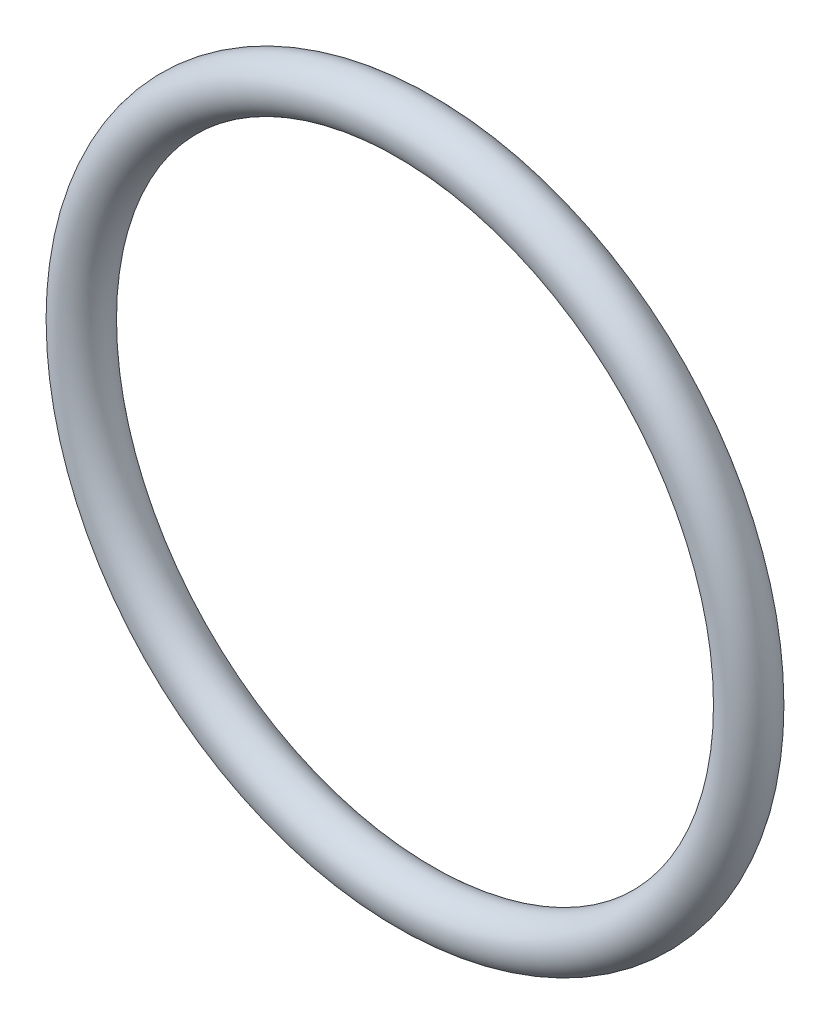
from build123d import *

# Parameters (mm, degrees)
SKETCH1_R = 0.889


with BuildPart() as part:
    # Sketch1 → Revolve1 (revolve)
    with BuildSketch(Plane(origin=(0, 0, 0), x_dir=(0, 0, -1), z_dir=(1, 0, 0)), mode=Mode.PRIVATE) as revolve1_sk:
        with Locations((0, 11.90625)):
            Circle(SKETCH1_R)
    revolve(revolve1_sk.sketch.rotate(Axis((0, 0, 151.155192532), (0, 0, -1)), 90), axis=Axis((0, 0, 151.155192532), (0, 0, -1)))


solid = part.part
